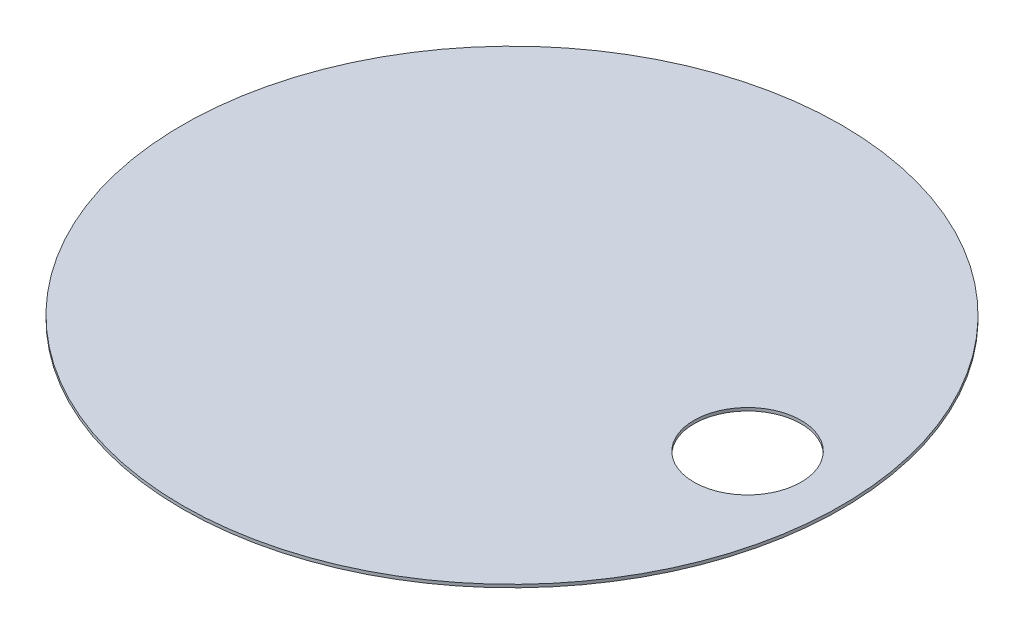
from build123d import *

# Parameters (mm, degrees)
SKETCH_1_R               = 326
EXTRUDE_1_DEPTH          = 1.5
SKETCH_3_R               = 10
EXTRUDE_2_DEPTH          = 6
CUT_EXTRUDE_1_DEPTH      = 462.072662386
CUT_EXTRUDE_1_DEPTH_BACK = 462.072662386
SKETCH_4_R               = 53


with BuildPart() as part:
    # 草图1 → 凸台-拉伸1 (new, symmetric)
    with BuildSketch(Plane(origin=(0, 0, 0), x_dir=(1, 0, 0), z_dir=(0, 1, 0))):
        with Locations(Location((0, 0, 0), (0, 0, 270))):
            Circle(SKETCH_1_R)
    extrude(amount=EXTRUDE_1_DEPTH, both=True)

    # 草图3 → 凸台-拉伸2 (add)
    with BuildSketch(Plane(origin=(0, 0, 0), x_dir=(1, 0, 0), z_dir=(0, 1, 0))):
        with Locations(Location((0, 0, 0), (0, 0, 270))):
            Circle(SKETCH_3_R)
    extrude(amount=-EXTRUDE_2_DEPTH)

    # 草图4 → 切除-拉伸1 (cut, two sides: drawn at the far end of the back side and taken through both)
    with BuildSketch(Plane(origin=(0, 0, 0), x_dir=(1, 0, 0), z_dir=(0, 1, 0)).offset(-CUT_EXTRUDE_1_DEPTH_BACK)):
        with Locations(Location((233, 0, 0), (0, 0, 270))):
            Circle(SKETCH_4_R)
    extrude(amount=CUT_EXTRUDE_1_DEPTH + CUT_EXTRUDE_1_DEPTH_BACK, mode=Mode.SUBTRACT)


solid = part.part
